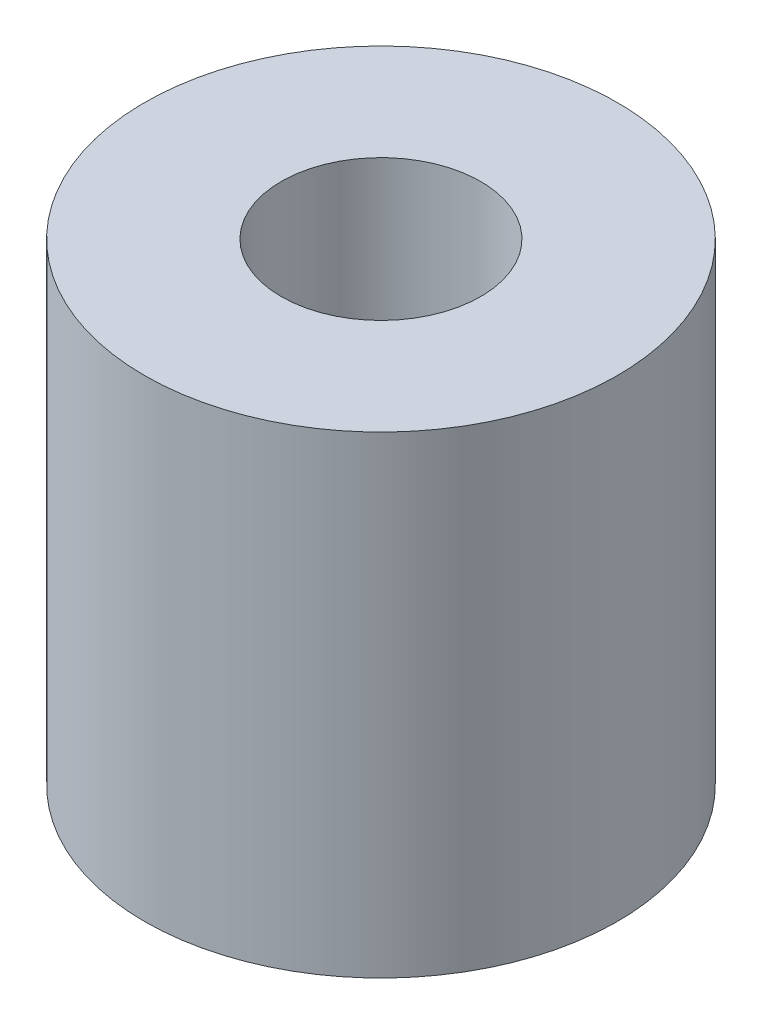
from build123d import *

# Parameters (mm, degrees)
SKETCH1_R               = 12.7
BOSS_EXTRUDE1_DEPTH     = 25.4
F_1_2_13_TAPPED_HOLE1_D = 10.71626


with BuildPart() as part:
    # Sketch1 → Boss-Extrude1 (new body)
    with BuildSketch(Plane(origin=(0, 0, 0), x_dir=(1, 0, 0), z_dir=(0, 1, 0))):
        with Locations(Location((0, 0, 0), (0, 0, 270))):
            Circle(SKETCH1_R)
    extrude(amount=BOSS_EXTRUDE1_DEPTH)

    # 1/2-13 Tapped Hole1 (through all)
    with Locations(Plane(origin=(0, 25.4, 0), x_dir=(1, 0, 0), z_dir=(0, 1, 0))):
        with Locations((0, 0)):
            Hole(F_1_2_13_TAPPED_HOLE1_D / 2)


solid = part.part
